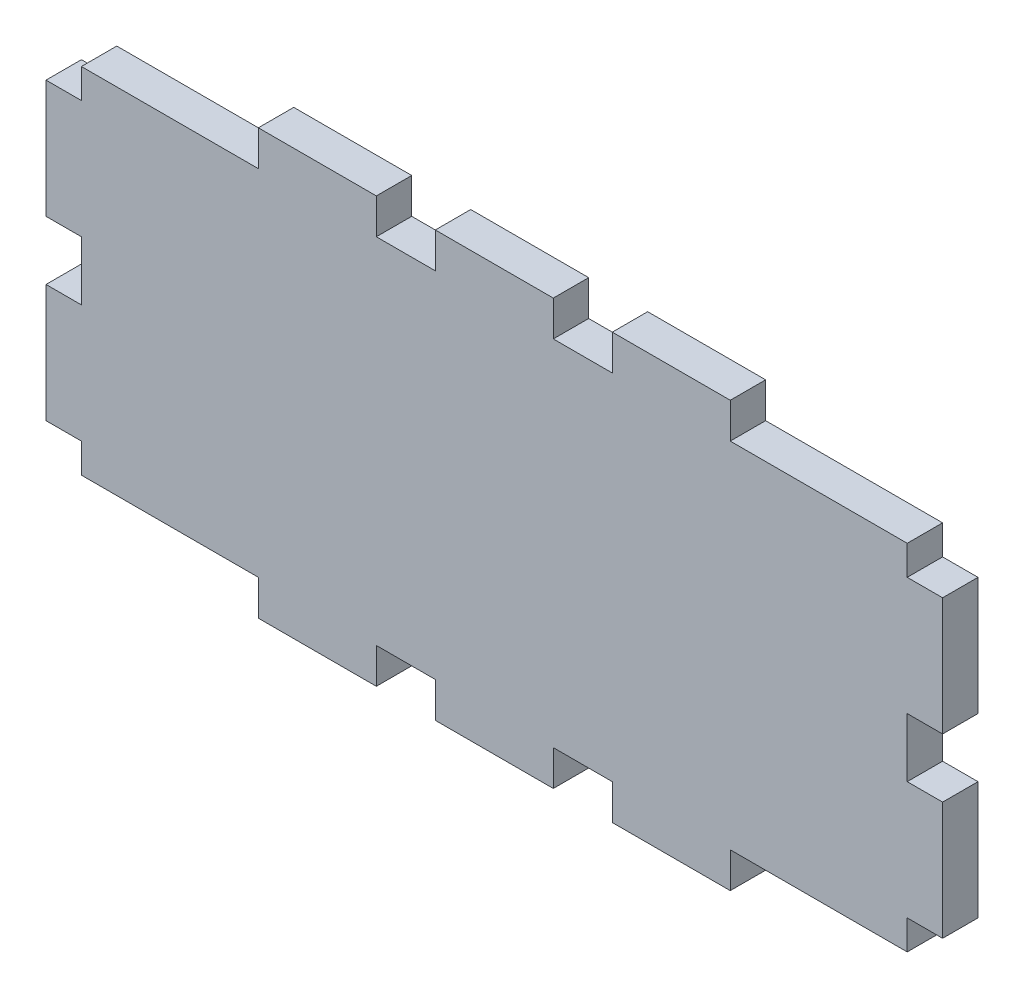
from build123d import *

# Parameters (mm, degrees)
EXTRUDE_1_DEPTH = 3


with BuildPart() as part:
    # 草图1 → 凸台-拉伸1 (new body)
    with BuildSketch(Plane.XY):
        Polygon((-5, 15), (-5, 18), (5, 18), (5, 15), (10, 15), (10, 18), (20, 18), (20, 15), (35, 15), (35, 12.5), (38, 12.5), (38, 2.5), (35, 2.5), (35, -2.5), (38, -2.5), (38, -12.5), (35, -12.5), (35, -15), (20, -15), (20, -18), (10, -18), (10, -15), (5, -15), (5, -18), (-5, -18), (-5, -15), (-10, -15), (-10, -18), (-20, -18), (-20, -15), (-35, -15), (-35, -12.5), (-38, -12.5), (-38, -2.5), (-35, -2.5), (-35, 2.5), (-38, 2.5), (-38, 12.5), (-35, 12.5), (-35, 15), (-20, 15), (-20, 18), (-10, 18), (-10, 15), align=None)
    extrude(amount=EXTRUDE_1_DEPTH)


solid = part.part
